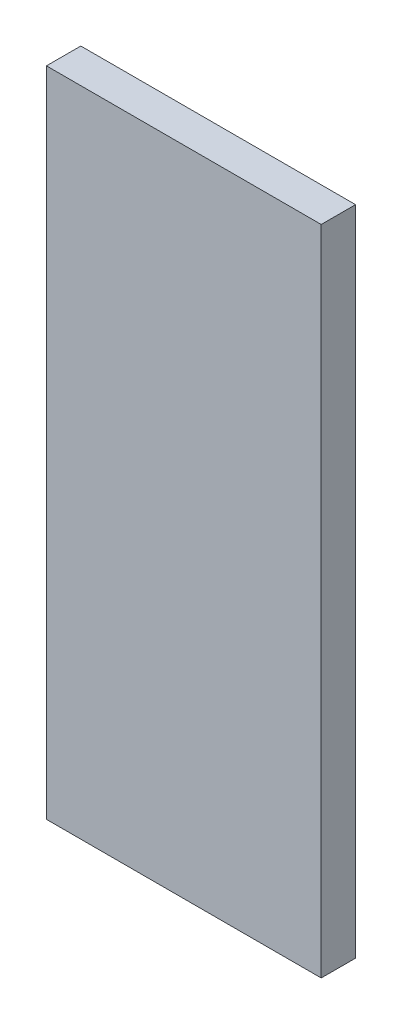
from build123d import *

# Parameters (mm, degrees)
SKETCH1_W           = 25.4
SKETCH1_H           = 60.325
BOSS_EXTRUDE1_DEPTH = 3.175


with BuildPart() as part:
    # Sketch1 → Boss-Extrude1 (new body)
    with BuildSketch(Plane.XY):
        with Locations((12.7, -30.1625)):
            Rectangle(SKETCH1_W, SKETCH1_H)
    extrude(amount=BOSS_EXTRUDE1_DEPTH)


solid = part.part
